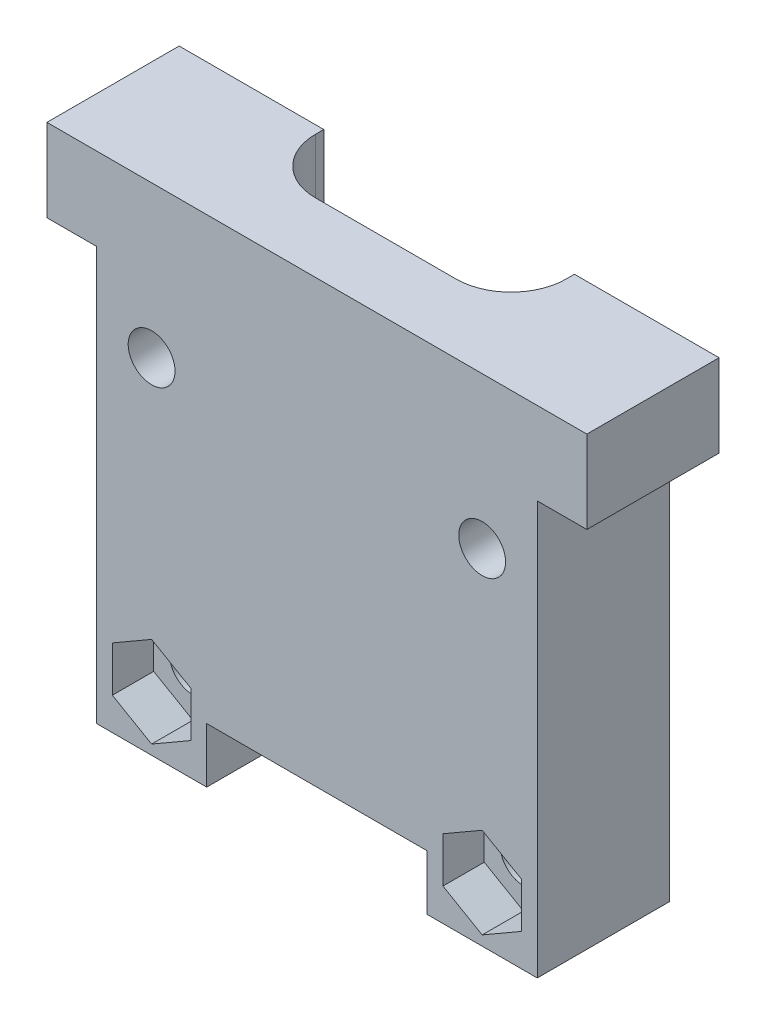
from build123d import *

# Parameters (mm, degrees)
EXTRUDE_1_DEPTH     = 16
CUT_EXTRUDE_1_DEPTH = 29
FILLET_1_R          = 3
SKETCH_3_R          = 1.7
CUT_EXTRUDE_2_DEPTH = 16
SKETCH_4_R          = 2.2
CUT_EXTRUDE_3_DEPTH = 3.0606
CUT_EXTRUDE_4_DEPTH = 3
EXTRUDE_START       = 13
SKETCH_6_W          = 8
SKETCH_6_H          = 8
SKETCH_6_R          = 1.7
EXTRUDE_2_DEPTH     = 13
SKETCH_8_W          = 39.2
SKETCH_8_H          = 19.2
EXTRUDE_3_DEPTH     = 6
SKETCH_9_W          = 41.779638264
SKETCH_9_H          = 22.131707322
CUT_EXTRUDE_5_DEPTH = 45.001818144


with BuildPart() as part:
    # Эскиз1 → Бобышка-Вытянуть1 (new body)
    with BuildSketch(Plane.XY):
        Polygon((8, -16), (-8, -16), (-8, -20), (-16, -20), (-16, -16), (-16, 16), (16, 16), (16, -16), (16, -20), (8, -20), align=None)
    extrude(amount=EXTRUDE_1_DEPTH)

    # Эскиз2 → Вырез-Вытянуть1 (cut)
    with BuildSketch(Plane(origin=(0, 16, 0), x_dir=(1, 0, 0), z_dir=(0, 1, 0))):
        with BuildLine():
            Line((5.1, -11), (-5.1, -11))
            ThreePointArc((-5.1, -11), (-7.928427125, -9.828427125), (-9.1, -7))
            Line((-9.1, -7), (-9.1, -5.8))
            ThreePointArc((-9.1, -5.8), (-7.928427125, -2.971572875), (-5.1, -1.8))
            Line((-5.1, -1.8), (5.1, -1.8))
            ThreePointArc((5.1, -1.8), (7.928427125, -2.971572875), (9.1, -5.8))
            Line((9.1, -5.8), (9.1, -7))
            ThreePointArc((9.1, -7), (7.928427125, -9.828427125), (5.1, -11))
        make_face()
    extrude(amount=-CUT_EXTRUDE_1_DEPTH, mode=Mode.SUBTRACT)

    # Скругление1
    fillet_1_edges = [part.edges().sort_by_distance(p)[0] for p in [
        (7.928427125, -13, 2.971572875),
        (9.1, -13, 6.4),
        (7.928427125, -13, 9.828427125),
        (0, -13, 11),
        (-7.928427125, -13, 9.828427125),
        (-9.1, -13, 6.4),
        (-7.928427125, -13, 2.971572875),
        (0, -13, 1.8),
    ]]
    fillet(fillet_1_edges, radius=FILLET_1_R)

    # Эскиз3 → Вырез-Вытянуть2 (cut)
    with BuildSketch(Plane(origin=(0, 0, 0), x_dir=(-1, 0, 0), z_dir=(0, 0, -1))):
        with Locations((-12, -16)):
            Circle(SKETCH_3_R)
        with Locations((-12, 5)):
            Circle(SKETCH_3_R)
        with Locations(Location((12, 5, 0), (0, 0, 180))):
            Circle(SKETCH_3_R)
        with Locations(Location((12, -16, 0), (0, 0, 180))):
            Circle(SKETCH_3_R)
    extrude(amount=-CUT_EXTRUDE_2_DEPTH, mode=Mode.SUBTRACT)

    # Эскиз4 → Вырез-Вытянуть3 (cut)
    with BuildSketch(Plane(origin=(0, -16, 0), x_dir=(1, 0, 0), z_dir=(0, 1, 0))):
        with Locations(Location((0, -6.4, 0), (0, 0, 133.341758227))):
            Circle(SKETCH_4_R)
    extrude(amount=CUT_EXTRUDE_3_DEPTH, mode=Mode.SUBTRACT)

    # Эскиз5 → Вырез-Вытянуть4 (cut)
    with BuildSketch(Plane.XY.offset(16)):
        Polygon((-12, -12.709103466), (-14.85, -14.354551733), (-14.85, -17.645448267), (-12, -19.290896534), (-9.15, -17.645448267), (-9.15, -14.354551733), align=None)
        Polygon((9.15, -14.354551733), (12, -12.709103466), (14.85, -14.354551733), (14.85, -17.645448267), (12, -19.290896534), (9.15, -17.645448267), align=None)
    extrude(amount=-CUT_EXTRUDE_4_DEPTH, mode=Mode.SUBTRACT)

    # Эскиз6 → Бобышка-Вытянуть2 (add)
    # profile 1 of 2: a face of its own
    with BuildSketch(Plane(origin=(0, 0, 0), x_dir=(-1, 0, 0), z_dir=(0, 0, -1)).offset(EXTRUDE_START)):
        with Locations((-12, -16)):
            Rectangle(SKETCH_6_W, SKETCH_6_H)
        with Locations((-12, -16)):
            Circle(SKETCH_6_R, mode=Mode.SUBTRACT)
    # profile 2 of 2: a face of its own
    with BuildSketch(Plane(origin=(0, 0, 0), x_dir=(-1, 0, 0), z_dir=(0, 0, -1)).offset(EXTRUDE_START)):
        with Locations((12, -16)):
            Rectangle(SKETCH_6_W, SKETCH_6_H)
        with Locations(Location((12, -16, 0), (0, 0, 180))):
            Circle(SKETCH_6_R, mode=Mode.SUBTRACT)
    extrude(amount=-EXTRUDE_2_DEPTH)

    # Эскиз8 → Бобышка-Вытянуть3 (add)
    with BuildSketch(Plane(origin=(0, 16, 0), x_dir=(1, 0, 0), z_dir=(0, 1, 0))):
        with Locations((0, -6.4)):
            Rectangle(SKETCH_8_W, SKETCH_8_H)
        with BuildLine():
            Line((-9.1, -5.8), (-9.1, -7))
            ThreePointArc((-9.1, -7), (-7.928427125, -9.828427125), (-5.1, -11))
            Line((-5.1, -11), (5.1, -11))
            ThreePointArc((5.1, -11), (7.928427125, -9.828427125), (9.1, -7))
            Line((9.1, -7), (9.1, -5.8))
            ThreePointArc((9.1, -5.8), (7.928427125, -2.971572875), (5.1, -1.8))
            Line((5.1, -1.8), (-5.1, -1.8))
            ThreePointArc((-5.1, -1.8), (-7.928427125, -2.971572875), (-9.1, -5.8))
        make_face(mode=Mode.SUBTRACT)
    extrude(amount=-EXTRUDE_3_DEPTH)

    # Эскиз9 → Вырез-Вытянуть5 (cut, through all)
    with BuildSketch(Plane(origin=(0, 16, 0), x_dir=(1, 0, 0), z_dir=(0, 1, 0))):
        with Locations((1.289819132, 4.665853661)):
            Rectangle(SKETCH_9_W, SKETCH_9_H)
    extrude(amount=-CUT_EXTRUDE_5_DEPTH, mode=Mode.SUBTRACT)


solid = part.part
